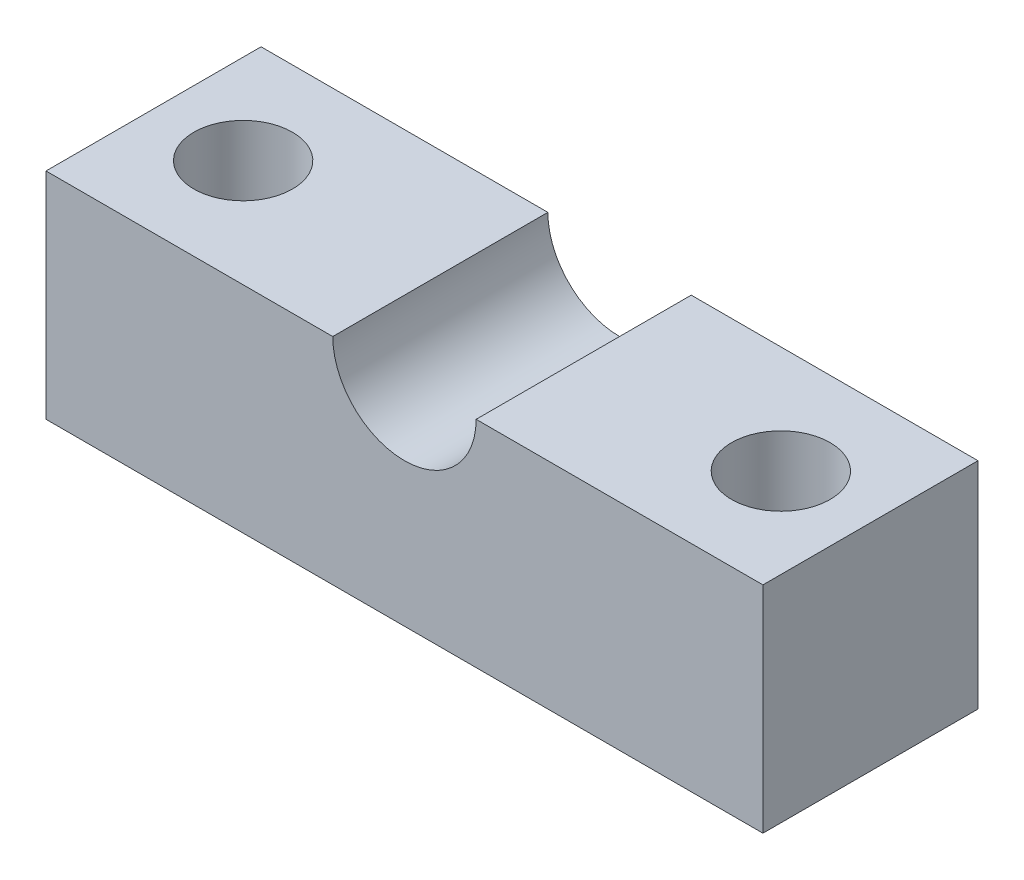
from build123d import *

# Parameters (mm, degrees)
AUFSATZ_LINEAR_AUSTRAGEN1_DEPTH  = 12
F_5_5_5_5_DURCHMESSER_BOHRUNG1_D = 5.5


with BuildPart() as part:
    # Skizze1 → Aufsatz-Linear austragen1 (new body)
    with BuildSketch(Plane.XY):
        with BuildLine():
            Line((24, 12), (40, 12))
            Line((40, 12), (40, 0))
            Line((40, 0), (0, 0))
            Line((0, 0), (0, 12))
            Line((0, 12), (16, 12))
            ThreePointArc((16, 12), (20, 8), (24, 12))
        make_face()
    extrude(amount=AUFSATZ_LINEAR_AUSTRAGEN1_DEPTH)

    # Ø5.5 (5.5) Durchmesser Bohrung1 (through all)
    with Locations(Plane(origin=(0, 0, 0), x_dir=(-1, 0, 0), z_dir=(0, -1, 0))):
        with Locations((-5, -6), (-35, -6)):
            Hole(F_5_5_5_5_DURCHMESSER_BOHRUNG1_D / 2)


solid = part.part
